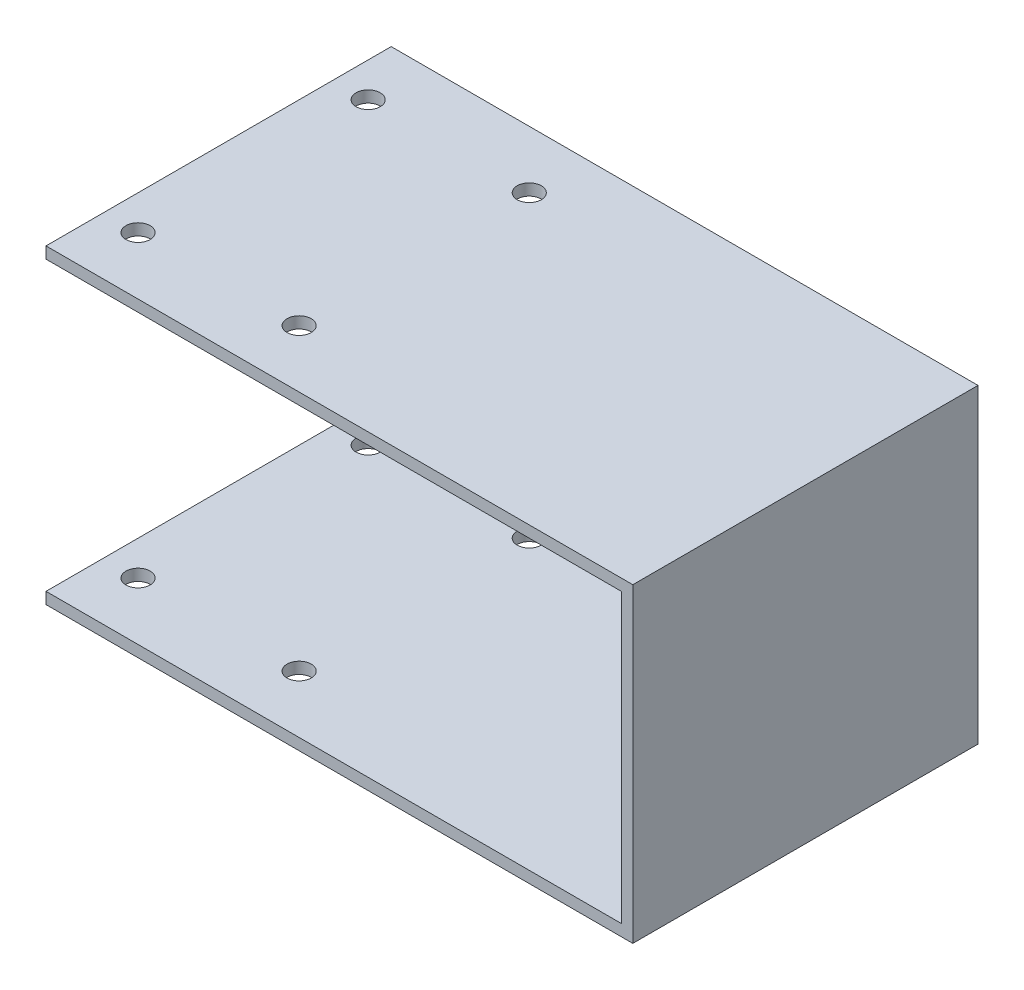
from build123d import *

# Parameters (mm, degrees)
EXTRUDE_1_DEPTH         = 60
CUT_EXTRUDE1_DEPTH      = 130.259429056
CUT_EXTRUDE1_DEPTH_BACK = 130.259429056
SKETCH1_R               = 2.1


with BuildPart() as part:
    # 草图1 → 凸台-拉伸1 (new body)
    with BuildSketch(Plane.XY):
        Polygon((0, 0), (0, 2), (102, 2), (102, -52), (0, -52), (0, -50), (100, -50), (100, 0), align=None)
    extrude(amount=EXTRUDE_1_DEPTH)

    # Sketch1 → Cut-Extrude1 (cut, two sides: drawn at the far end of the back side and taken through both)
    with BuildSketch(Plane(origin=(0, 0, 0), x_dir=(1, 0, 0), z_dir=(0, 1, 0)).offset(-CUT_EXTRUDE1_DEPTH_BACK)):
        with Locations(Location((6, -10, 0), (0, 0, 270))):
            Circle(SKETCH1_R)
        with Locations(Location((34, -10, 0), (0, 0, 270))):
            Circle(SKETCH1_R)
        with Locations(Location((34, -50, 0), (0, 0, 270))):
            Circle(SKETCH1_R)
        with Locations(Location((6, -50, 0), (0, 0, 270))):
            Circle(SKETCH1_R)
    extrude(amount=CUT_EXTRUDE1_DEPTH + CUT_EXTRUDE1_DEPTH_BACK, mode=Mode.SUBTRACT)


solid = part.part
